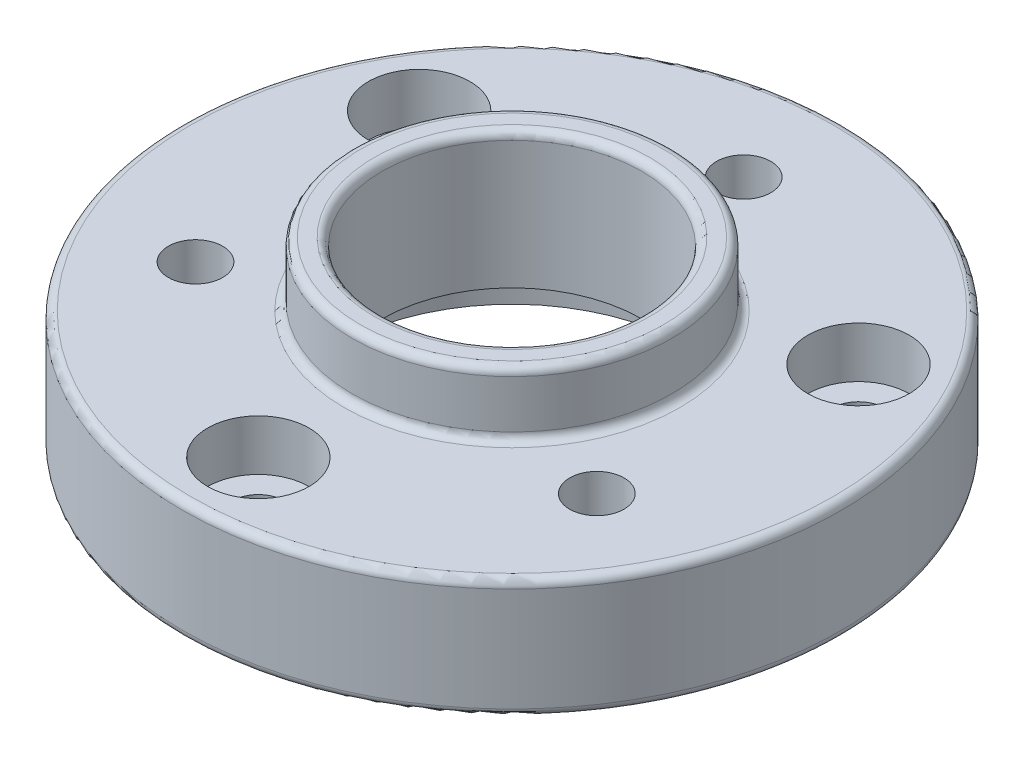
from build123d import *

# Parameters (mm, degrees)
SKETCH2_R                                            = 41.25
BOSS_EXTRUDE1_DEPTH                                  = 15
SKETCH3_R                                            = 20
SKETCH3_R_2                                          = 16.25
BOSS_EXTRUDE2_DEPTH                                  = 8
SKETCH4_R                                            = 16.25
CUT_EXTRUDE1_DEPTH                                   = 61.233919016
SKETCH5_R                                            = 22.225
SKETCH5_R_2                                          = 16.25
CUT_EXTRUDE2_DEPTH                                   = 6
CBORE_FOR_1_4_BINDING_HEAD_MACHINE_SCREW_D           = 6.5278
CBORE_FOR_1_4_BINDING_HEAD_MACHINE_SCREW_CBORE_D     = 12.7
CBORE_FOR_1_4_BINDING_HEAD_MACHINE_SCREW_CBORE_DEPTH = 6.35
FILLET1_R                                            = 1
M8X1_25_TAPPED_HOLE1_D                               = 6.8


with BuildPart() as part:
    # Sketch2 → Boss-Extrude1 (new body)
    with BuildSketch(Plane(origin=(0, 0, 0), x_dir=(1, 0, 0), z_dir=(0, 1, 0))):
        with Locations(Location((0, 0, 0), (0, 0, 270))):
            Circle(SKETCH2_R)
    extrude(amount=BOSS_EXTRUDE1_DEPTH)

    # Sketch3 → Boss-Extrude2 (add)
    with BuildSketch(Plane(origin=(0, 15, 0), x_dir=(1, 0, 0), z_dir=(0, 1, 0))):
        with Locations(Location((0, 0, 0), (0, 0, 270))):
            Circle(SKETCH3_R)
        with Locations(Location((0, 0, 0), (0, 0, 270))):
            Circle(SKETCH3_R_2, mode=Mode.SUBTRACT)
    extrude(amount=BOSS_EXTRUDE2_DEPTH)

    # Sketch4 → Cut-Extrude1 (cut, through all)
    with BuildSketch(Plane(origin=(0, 15, 0), x_dir=(1, 0, 0), z_dir=(0, 1, 0))):
        with Locations(Location((0, 0, 0), (0, 0, 270))):
            Circle(SKETCH4_R)
    extrude(amount=-CUT_EXTRUDE1_DEPTH, mode=Mode.SUBTRACT)

    # Sketch5 → Cut-Extrude2 (cut)
    with BuildSketch(Plane.XZ):
        with Locations(Location((0, 0, 0), (0, 0, 270))):
            Circle(SKETCH5_R)
        with Locations(Location((0, 0, 0), (0, 0, 270))):
            Circle(SKETCH5_R_2, mode=Mode.SUBTRACT)
    extrude(amount=-CUT_EXTRUDE2_DEPTH, mode=Mode.SUBTRACT)

    # CBORE for 1/4 Binding Head Machine Screw1 (through all)
    with Locations(Plane(origin=(0, 15, 0), x_dir=(1, 0, 0), z_dir=(0, 1, 0))):
        with Locations((27.49630657, 15.875), (0, -31.75), (-27.49630657, 15.875)):
            CounterBoreHole(CBORE_FOR_1_4_BINDING_HEAD_MACHINE_SCREW_D / 2, CBORE_FOR_1_4_BINDING_HEAD_MACHINE_SCREW_CBORE_D / 2, CBORE_FOR_1_4_BINDING_HEAD_MACHINE_SCREW_CBORE_DEPTH)

    # Fillet1
    fillet1_edges = [part.edges().sort_by_distance(p)[0] for p in [
        (0, 0, -41.25),
        (0, 6, 22.225),
        (0, 15, -41.25),
        (0, 23, -20),
        (0, 15, -20),
        (0, 23, -16.25),
    ]]
    fillet(fillet1_edges, radius=FILLET1_R)

    # M8x1.25 Tapped Hole1 (through all)
    with Locations(Plane(origin=(0, 15, 0), x_dir=(1, 0, 0), z_dir=(0, 1, 0))):
        with Locations((0, 29), (25.11473671, -14.5), (-25.11473671, -14.5)):
            Hole(M8X1_25_TAPPED_HOLE1_D / 2)


solid = part.part
